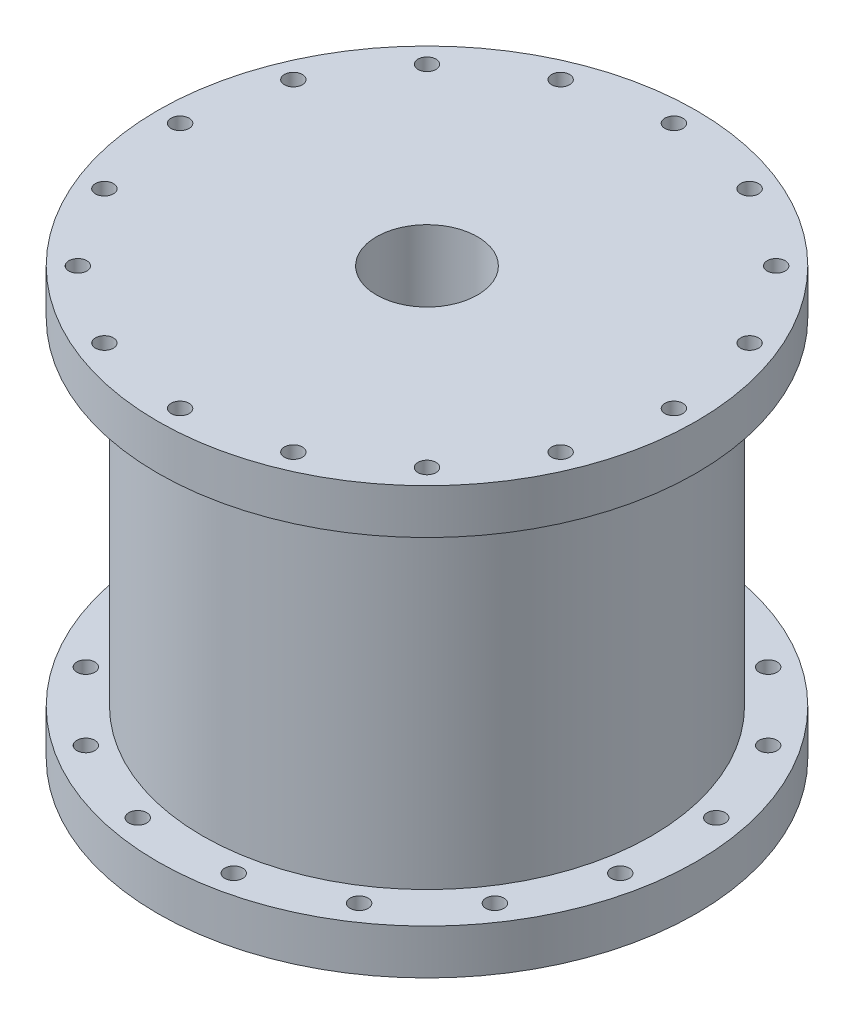
from build123d import *

# Parameters (mm, degrees)
SKETCH4_R          = 5.621513677
CUT_EXTRUDE1_DEPTH = 64.627776498
SKETCH5_R          = 1
CUT_EXTRUDE2_DEPTH = 60.991308336
CIRPATTERN2_COUNT  = 16
CUT_EXTRUDE3_REACH = 65.628
SKETCH7_R          = 1
CIRPATTERN3_COUNT  = 16


with BuildPart() as part:
    # Sketch3 → Revolve1 (revolve)
    with BuildSketch(Plane(origin=(0, 0, 0), x_dir=(0, 0, -1), z_dir=(1, 0, 0))):
        Polygon((29.972, 0), (0, 0), (0, 47.453686622), (29.972, 47.453686622), (29.972, 42.453686622), (24.993307857, 42.453686622), (24.993307857, 5), (29.972, 5), align=None)
    revolve(axis=Axis((0, 47.453686622, 0), (0, 1, 0)))

    # Sketch4 → Cut-Extrude1 (cut, through all)
    with BuildSketch(Plane(origin=(0, 47.453686622, 0), x_dir=(1, 0, 0), z_dir=(0, 1, 0))):
        with Locations(Location((0, 0, 0), (0, 0, 270))):
            Circle(SKETCH4_R)
    extrude(amount=-CUT_EXTRUDE1_DEPTH, mode=Mode.SUBTRACT)

    # Sketch5 → Cut-Extrude2 (cut, through all)
    with BuildSketch(Plane.XZ.offset(-42.453686622)):
        with Locations(Location((0, 27.482653928, 0), (0, 0, 270))):
            Circle(SKETCH5_R)
    cut_extrude2 = extrude(amount=-CUT_EXTRUDE2_DEPTH, mode=Mode.SUBTRACT)

    # CirPattern2: Cut-Extrude2 ×16 about axis
    cirpattern2_axis = Axis((0, 0, 0), (0, 1, 0))
    for i in range(1, CIRPATTERN2_COUNT):
        add(cut_extrude2.rotate(cirpattern2_axis, i * 360 / CIRPATTERN2_COUNT), mode=Mode.SUBTRACT)

    # Sketch7 → Cut-Extrude3 (cut, up to next)
    with BuildSketch(Plane.XZ, mode=Mode.PRIVATE) as cut_extrude3_sk1:
        with Locations(Location((-5.341086171, 26.85145344, 0), (0, 0, 270))):
            Circle(SKETCH7_R)
    cut_extrude3_tool1 = extrude(cut_extrude3_sk1.sketch, amount=-CUT_EXTRUDE3_REACH, mode=Mode.PRIVATE) & part.part
    cut_extrude3 = cut_extrude3_tool1.solids().sort_by_distance((-5.341086, 0, 26.851453))[0]
    add(cut_extrude3, mode=Mode.SUBTRACT)

    # CirPattern3: Cut-Extrude3 ×16 about axis
    cirpattern3_axis = Axis((0, 0, 0), (0, 1, 0))
    for i in range(1, CIRPATTERN3_COUNT):
        add(cut_extrude3.rotate(cirpattern3_axis, i * 360 / CIRPATTERN3_COUNT), mode=Mode.SUBTRACT)


solid = part.part
